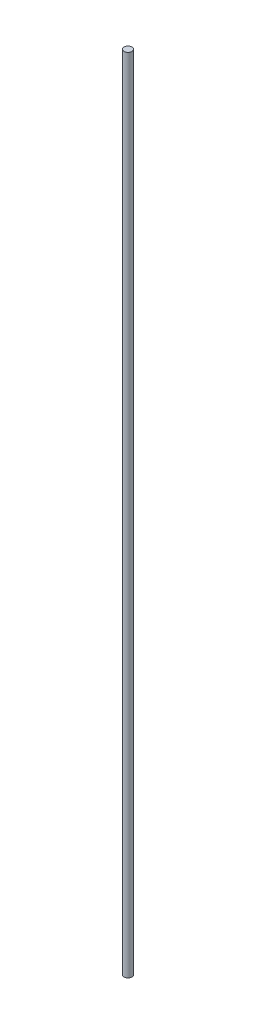
from build123d import *

# Parameters (mm, degrees)
BOSS_EXTRUDE1_DEPTH      = 420
BOSS_EXTRUDE1_DEPTH_BACK = 400
SKETCH1_R                = 4


with BuildPart() as part:
    # Sketch1 → Boss-Extrude1 (new, two sides: drawn at the far end of the back side and taken through both)
    with BuildSketch(Plane(origin=(0, 0, 0), x_dir=(1, 0, 0), z_dir=(0, 1, 0)).offset(-BOSS_EXTRUDE1_DEPTH_BACK)):
        with Locations(Location((0, 0, 0), (0, 0, 270))):
            Circle(SKETCH1_R)
    extrude(amount=BOSS_EXTRUDE1_DEPTH + BOSS_EXTRUDE1_DEPTH_BACK)


solid = part.part
